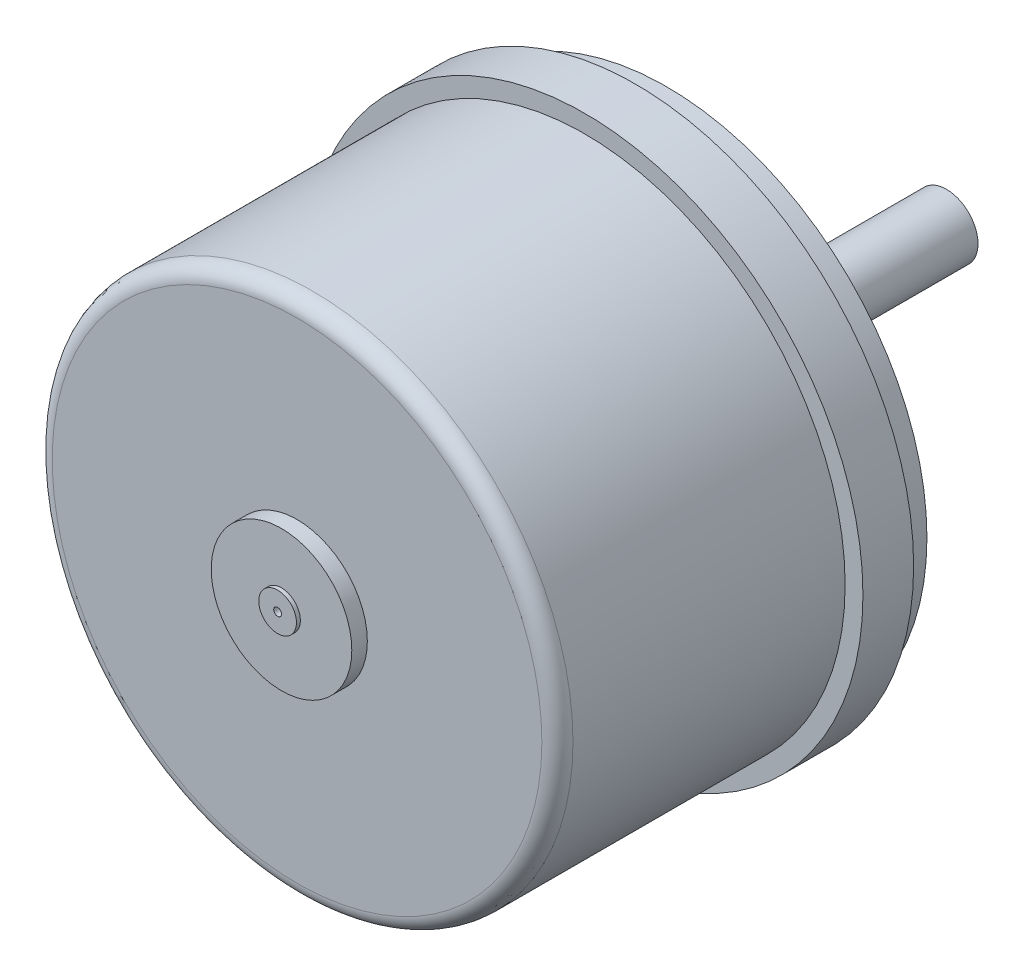
from build123d import *

# Parameters (mm, degrees)
CROQUIS1_R              = 33.485
SALIENTE_EXTRUIR1_DEPTH = 2
CROQUIS2_R              = 35.775
SALIENTE_EXTRUIR2_DEPTH = 6.52
SALIENTE_EXTRUIR3_START = 37
CROQUIS3_R              = 33.485
SALIENTE_EXTRUIR3_DEPTH = 37
CROQUIS4_R              = 9.04
SALIENTE_EXTRUIR4_DEPTH = 2
CROQUIS5_R              = 2.425
SALIENTE_EXTRUIR5_DEPTH = 0.5
CROQUIS6_R              = 0.5
CORTAR_EXTRUIR1_DEPTH   = 1
CROQUIS7_R              = 4.05
SALIENTE_EXTRUIR6_DEPTH = 36
REDONDEO2_R             = 2


with BuildPart() as part:
    # Croquis1 → Saliente-Extruir1 (new, symmetric)
    with BuildSketch(Plane.XY):
        Circle(CROQUIS1_R)
    extrude(amount=SALIENTE_EXTRUIR1_DEPTH, both=True)

    # Croquis2 → Saliente-Extruir2 (add)
    with BuildSketch(Plane.XY.offset(2)):
        Circle(CROQUIS2_R)
    extrude(amount=SALIENTE_EXTRUIR2_DEPTH)

    # Croquis3 → Saliente-Extruir3 (add)
    with BuildSketch(Plane.XY.offset(8.52).offset(SALIENTE_EXTRUIR3_START)):
        Circle(CROQUIS3_R)
    extrude(amount=-SALIENTE_EXTRUIR3_DEPTH)

    # Croquis4 → Saliente-Extruir4 (add)
    with BuildSketch(Plane.XY.offset(45.52)):
        Circle(CROQUIS4_R)
    extrude(amount=SALIENTE_EXTRUIR4_DEPTH)

    # Croquis5 → Saliente-Extruir5 (add)
    with BuildSketch(Plane.XY.offset(47.52)):
        Circle(CROQUIS5_R)
    extrude(amount=SALIENTE_EXTRUIR5_DEPTH)

    # Croquis6 → Cortar-Extruir1 (cut)
    with BuildSketch(Plane.XY.offset(48.02)):
        Circle(CROQUIS6_R)
    extrude(amount=-CORTAR_EXTRUIR1_DEPTH, mode=Mode.SUBTRACT)

    # Croquis7 → Saliente-Extruir6 (add)
    with BuildSketch(Plane(origin=(0, 0, -2), x_dir=(-1, 0, 0), z_dir=(0, 0, -1))):
        with Locations(Location((0, 0, 0), (0, 0, 180))):
            Circle(CROQUIS7_R)
    extrude(amount=SALIENTE_EXTRUIR6_DEPTH)

    # Redondeo2
    redondeo2_edges = [part.edges().sort_by_distance(p)[0] for p in [
        (-33.485, 0, 45.52),
    ]]
    fillet(redondeo2_edges, radius=REDONDEO2_R)


solid = part.part
